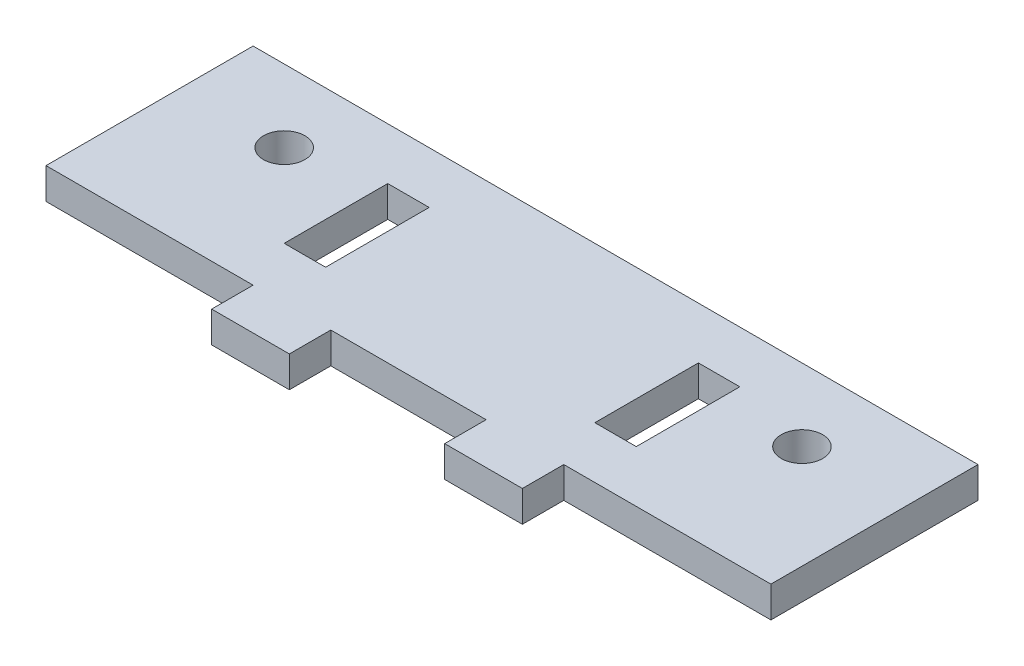
from build123d import *

# Parameters (mm, degrees)
SKETCH1_R           = 2
SKETCH1_W           = 4
SKETCH1_H           = 10
BOSS_EXTRUDE1_DEPTH = 3


with BuildPart() as part:
    # Sketch1 → Boss-Extrude1 (new body)
    with BuildSketch(Plane(origin=(0, 0, 0), x_dir=(1, 0, 0), z_dir=(0, 1, 0))):
        Polygon((0, 0), (20, 0), (20, -4), (27.5, -4), (27.5, 0), (42.5, 0), (42.5, -4), (50, -4), (50, 0), (70, 0), (70, 20), (0, 20), align=None)
        with Locations(Location((10, 13, 0), (0, 0, 270))):
            Circle(SKETCH1_R, mode=Mode.SUBTRACT)
        with Locations(Location((60, 13, 0), (0, 0, 90))):
            Circle(SKETCH1_R, mode=Mode.SUBTRACT)
        with Locations((20, 10)):
            Rectangle(SKETCH1_W, SKETCH1_H, mode=Mode.SUBTRACT)
        with Locations((50, 10)):
            Rectangle(SKETCH1_W, SKETCH1_H, mode=Mode.SUBTRACT)
    extrude(amount=BOSS_EXTRUDE1_DEPTH)


solid = part.part
